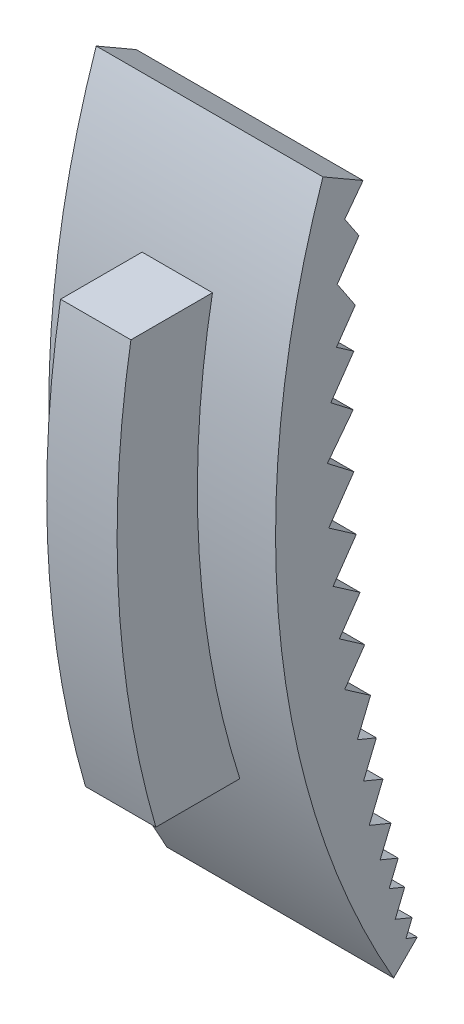
from build123d import *

# Parameters (mm, degrees)
Y_KSEKLIK_EKSTR_ZYON1_DEPTH = 1.8922999999999999
Y_KSEKLIK_EKSTR_ZYON2_DEPTH = 6.096
KES_EKSTR_ZYON1_DEPTH       = 12.192
KES_EKSTR_ZYON2_DEPTH       = 12.192


with BuildPart() as part:
    # Sketch1 → Yükseklik-Ekstrüzyon1 (new, symmetric)
    with BuildSketch(Plane(origin=(0, 0, 0), x_dir=(0, 0, -1), z_dir=(1, 0, 0))):
        with BuildLine():
            Line((12.699999999999989, 4.50157994432155), (13.96999999999999, 5.771579944321538))
            ThreePointArc((13.969999999999999, 5.771579944321534), (10.575518689521203, 28.624343729041474), (12.431741890335203, 51.65314637694648))
            ThreePointArc((12.43174189033521, 51.65314637694648), (9.202455413232371, 44.58343593858319), (7.160995779393552, 37.0840000000003))
            Line((7.160995779393725, 37.084000000000266), (2.774818775530208, 37.08399999999997))
            ThreePointArc((2.774818775530207, 37.08399999999997), (2.117821695541153, 25.3237007401097), (4.117213446385989, 13.715999999999998))
            Line((4.117213446385993, 13.716), (8.632497278528835, 13.716000000000273))
            ThreePointArc((8.632497278528902, 13.716000000000294), (10.422987595978043, 9.001407744129583), (12.699999999999989, 4.501579944321545))
        make_face()
    extrude(amount=Y_KSEKLIK_EKSTR_ZYON1_DEPTH, both=True)

    # Sketch1<3> → Yükseklik-Ekstrüzyon2 (add, symmetric)
    with BuildSketch(Plane(origin=(0, 0, 0), x_dir=(0, 0, -1), z_dir=(1, 0, 0))):
        with BuildLine():
            Line((12.699999999999989, 4.50157994432155), (13.96999999999999, 5.771579944321538))
            ThreePointArc((13.969999999999999, 5.771579944321534), (10.575518689521203, 28.624343729041474), (12.431741890335203, 51.65314637694648))
            ThreePointArc((12.43174189033521, 51.65314637694648), (10.513707619187393, 47.83097419138011), (8.944783317600844, 43.85274189332284))
            ThreePointArc((8.944783317600837, 43.85274189332284), (7.928882036124428, 40.50105103089301), (7.160995779393787, 37.08400000000025))
            ThreePointArc((7.160995779393787, 37.08400000000025), (6.444536577927558, 25.308553187264685), (8.632497278528902, 13.716000000000294))
            ThreePointArc((8.632497278528902, 13.716000000000294), (10.422987595978043, 9.001407744129583), (12.699999999999989, 4.501579944321545))
        make_face()
    extrude(amount=Y_KSEKLIK_EKSTR_ZYON2_DEPTH, both=True)

    # Çizim1 → Kes-Ekstrüzyon1 (cut)
    with BuildSketch(Plane(origin=(6.096, 0, 0), x_dir=(0, 0, -1), z_dir=(1, 0, 0))):
        Polygon((7.619999999999999, 44.44999999999999), (15.240000000000004, 40.05059094877499), (15.239999999999997, 52.750590948774985), (7.619999999999999, 52.75059094877498), align=None)
    extrude(amount=-KES_EKSTR_ZYON1_DEPTH, mode=Mode.SUBTRACT)

    # Çizim2 → Kes-Ekstrüzyon2 (cut)
    with BuildSketch(Plane(origin=(6.096, 0, 0), x_dir=(0, 0, -1), z_dir=(1, 0, 0))):
        Polygon((11.056013618254738, 42.46621661256137), (10.070471058059045, 41.15377647398756), (10.833720947179229, 40.007340668045536), (9.666309047244985, 38.32679905568005), (10.636905522114423, 36.868919313052004), (9.62569938139432, 35.41324287335203), (10.559264155717688, 34.76472895445507), (9.3197515804638, 32.980395197122455), (10.523316237219666, 32.057512510187244), (9.135536699136821, 30.24765907263679), (10.564730983672034, 29.1517655915009), (9.210366129696242, 27.20209684513998), (10.69333307665004, 26.171932969193865), (9.442971205595295, 24.37198116560075), (10.894662465129608, 23.36354338641027), (9.778604553235667, 21.756928135312357), (11.145926492174143, 20.80709869293918), (10.065994729447585, 19.252488648378726), (11.457703407949307, 18.285718613902816), (10.75224071965595, 16.57382862778652), (11.771303497493284, 16.153877128202204), (11.082697869529728, 14.482892824629843), (12.125579376165943, 14.05312572673812), (11.389100528431403, 12.265971302634858), (12.559321579832204, 11.783728112059473), (11.974340159118404, 10.364200399535543), (12.945895778380397, 9.963826400885022), (12.459272873487201, 8.782977446397027), (13.29695037716803, 8.437774058058789), (12.784445432106818, 7.194119222949248), (13.696666965760587, 6.818196552292981), (13.362164192489386, 6.006485376927448), (13.97000000000003, 5.771579944321571), (16.641220779657644, 5.771579944321571), (16.641220779657644, 42.46621661256137), align=None)
    extrude(amount=-KES_EKSTR_ZYON2_DEPTH, mode=Mode.SUBTRACT)


solid = part.part
